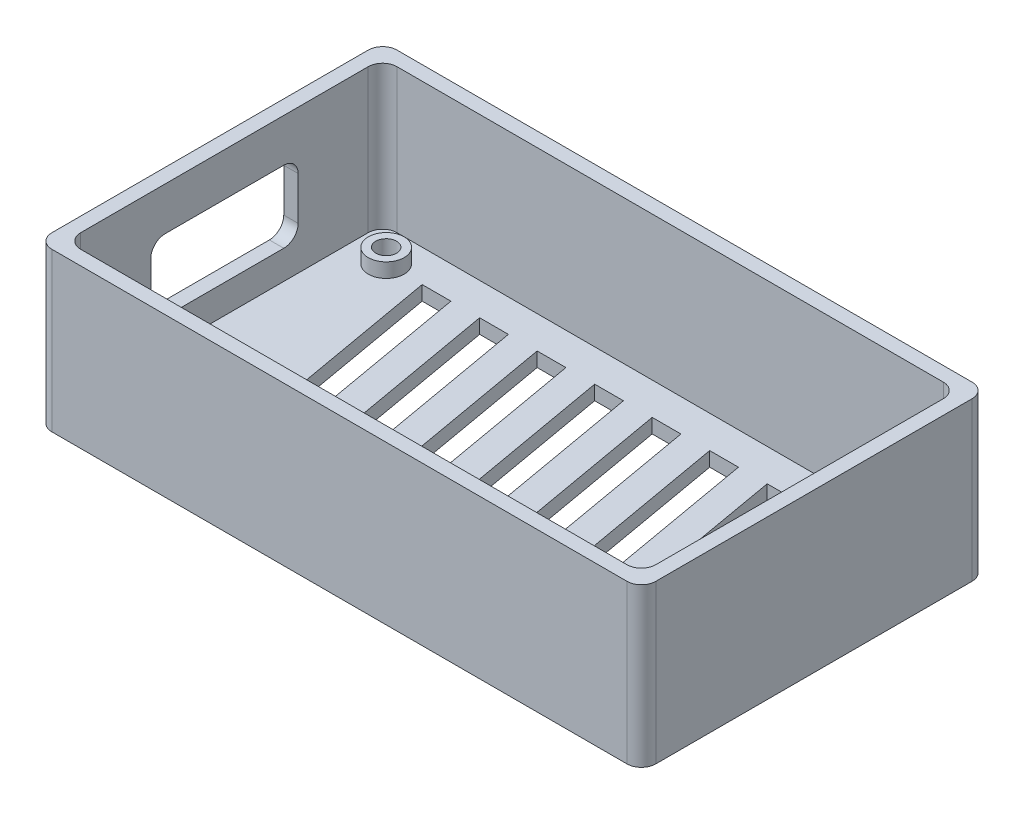
from build123d import *

# Parameters (mm, degrees)
EXTRUDE_1_DEPTH     = 2
EXTRUDE_START       = 20
EXTRUDE_3_DEPTH     = 20
SKETCH_1_5_R        = 2.5
SKETCH_1_5_R_2      = 1.45
EXTRUDE_4_DEPTH     = 2
CUT_EXTRUDE_2_DEPTH = 2
CUT_EXTRUDE_3_DEPTH = 2


with BuildPart() as part:
    # 草图1 → 凸台-拉伸1 (new body)
    with BuildSketch(Plane(origin=(0, 0, 0), x_dir=(1, 0, 0), z_dir=(0, 1, 0))):
        with BuildLine():
            Line((-40, 24), (40, 24))
            ThreePointArc((40, 24), (41.414213562, 23.414213562), (42, 22))
            Line((42, 22), (42, -22))
            ThreePointArc((42, -22), (41.414213562, -23.414213562), (40, -24))
            Line((40, -24), (-40, -24))
            ThreePointArc((-40, -24), (-41.414213562, -23.414213562), (-42, -22))
            Line((-42, -22), (-42, 22))
            ThreePointArc((-42, 22), (-41.414213562, 23.414213562), (-40, 24))
        make_face()
    extrude(amount=-EXTRUDE_1_DEPTH)

    # 草图1<4> → 凸台-拉伸3 (add)
    with BuildSketch(Plane(origin=(0, 0, 0), x_dir=(1, 0, 0), z_dir=(0, 1, 0)).offset(EXTRUDE_START)):
        with BuildLine():
            Line((-40, 24), (40, 24))
            ThreePointArc((40, 24), (41.414213562, 23.414213562), (42, 22))
            Line((42, 22), (42, -22))
            ThreePointArc((42, -22), (41.414213562, -23.414213562), (40, -24))
            Line((40, -24), (-40, -24))
            ThreePointArc((-40, -24), (-41.414213562, -23.414213562), (-42, -22))
            Line((-42, -22), (-42, 22))
            ThreePointArc((-42, 22), (-41.414213562, 23.414213562), (-40, 24))
        make_face()
        with BuildLine():
            Line((-38, 22), (38, 22))
            ThreePointArc((38, 22), (39.414213562, 21.414213562), (40, 20))
            Line((40, 20), (40, -20))
            ThreePointArc((40, -20), (39.414213562, -21.414213562), (38, -22))
            Line((38, -22), (-38, -22))
            ThreePointArc((-38, -22), (-39.414213562, -21.414213562), (-40, -20))
            Line((-40, -20), (-40, 20))
            ThreePointArc((-40, 20), (-39.414213562, 21.414213562), (-38, 22))
        make_face(mode=Mode.SUBTRACT)
    extrude(amount=-EXTRUDE_3_DEPTH)

    # 草图1<5> → 凸台-拉伸4 (add)
    # profile 1 of 4: a face of its own
    with BuildSketch(Plane(origin=(0, 0, 0), x_dir=(1, 0, 0), z_dir=(0, 1, 0))):
        with Locations((-35, 17.5)):
            Circle(SKETCH_1_5_R)
        with Locations((-35, 17.5)):
            Circle(SKETCH_1_5_R_2, mode=Mode.SUBTRACT)
    # profile 2 of 4: a face of its own
    with BuildSketch(Plane(origin=(0, 0, 0), x_dir=(1, 0, 0), z_dir=(0, 1, 0))):
        with Locations((35, 17.5)):
            Circle(SKETCH_1_5_R)
        with Locations((35, 17.5)):
            Circle(SKETCH_1_5_R_2, mode=Mode.SUBTRACT)
    # profile 3 of 4: a face of its own
    with BuildSketch(Plane(origin=(0, 0, 0), x_dir=(1, 0, 0), z_dir=(0, 1, 0))):
        with Locations((35, -17.5)):
            Circle(SKETCH_1_5_R)
        with Locations((35, -17.5)):
            Circle(SKETCH_1_5_R_2, mode=Mode.SUBTRACT)
    # profile 4 of 4: a face of its own
    with BuildSketch(Plane(origin=(0, 0, 0), x_dir=(1, 0, 0), z_dir=(0, 1, 0))):
        with Locations((-35, -17.5)):
            Circle(SKETCH_1_5_R)
        with Locations((-35, -17.5)):
            Circle(SKETCH_1_5_R_2, mode=Mode.SUBTRACT)
    extrude(amount=EXTRUDE_4_DEPTH)

    # 草图2 → 切除-拉伸2 (cut)
    with BuildSketch(Plane.XZ.offset(2)):
        Polygon((-19.828555675, 17.5), (-23.828555675, 17.5), (-30, -17.5), (-26, -17.5), align=None)
        Polygon((-30, 5.185127278), (-27.828555675, 17.5), (-30, 17.5), align=None)
        Polygon((-11.828555675, 17.5), (-15.828555675, 17.5), (-22, -17.5), (-18, -17.5), align=None)
        Polygon((-3.828555675, 17.5), (-7.828555675, 17.5), (-14, -17.5), (-10, -17.5), align=None)
        Polygon((4.171444325, 17.5), (0.171444325, 17.5), (-6, -17.5), (-2, -17.5), align=None)
        Polygon((12.171444325, 17.5), (8.171444325, 17.5), (2, -17.5), (6, -17.5), align=None)
        Polygon((20.171444325, 17.5), (16.171444325, 17.5), (10, -17.5), (14, -17.5), align=None)
        Polygon((28.171444325, 17.5), (24.171444325, 17.5), (18, -17.5), (22, -17.5), align=None)
        Polygon((30, 5.185127278), (26, -17.5), (30, -17.5), align=None)
    extrude(amount=-CUT_EXTRUDE_2_DEPTH, mode=Mode.SUBTRACT)

    # 草图3 → 切除-拉伸3 (cut)
    with BuildSketch(Plane(origin=(-40, 0, 0), x_dir=(0, 0, -1), z_dir=(1, 0, 0))):
        with BuildLine():
            Line((-10.25, 6), (-10.25, 12))
            ThreePointArc((-10.25, 12), (-9.664213562, 13.414213562), (-8.25, 14))
            Line((-8.25, 14), (8.25, 14))
            ThreePointArc((8.25, 14), (9.664213562, 13.414213562), (10.25, 12))
            Line((10.25, 12), (10.25, 6))
            ThreePointArc((10.25, 6), (9.664213562, 4.585786438), (8.25, 4))
            Line((8.25, 4), (-8.25, 4))
            ThreePointArc((-8.25, 4), (-9.664213562, 4.585786438), (-10.25, 6))
        make_face()
    extrude(amount=-CUT_EXTRUDE_3_DEPTH, mode=Mode.SUBTRACT)


solid = part.part
